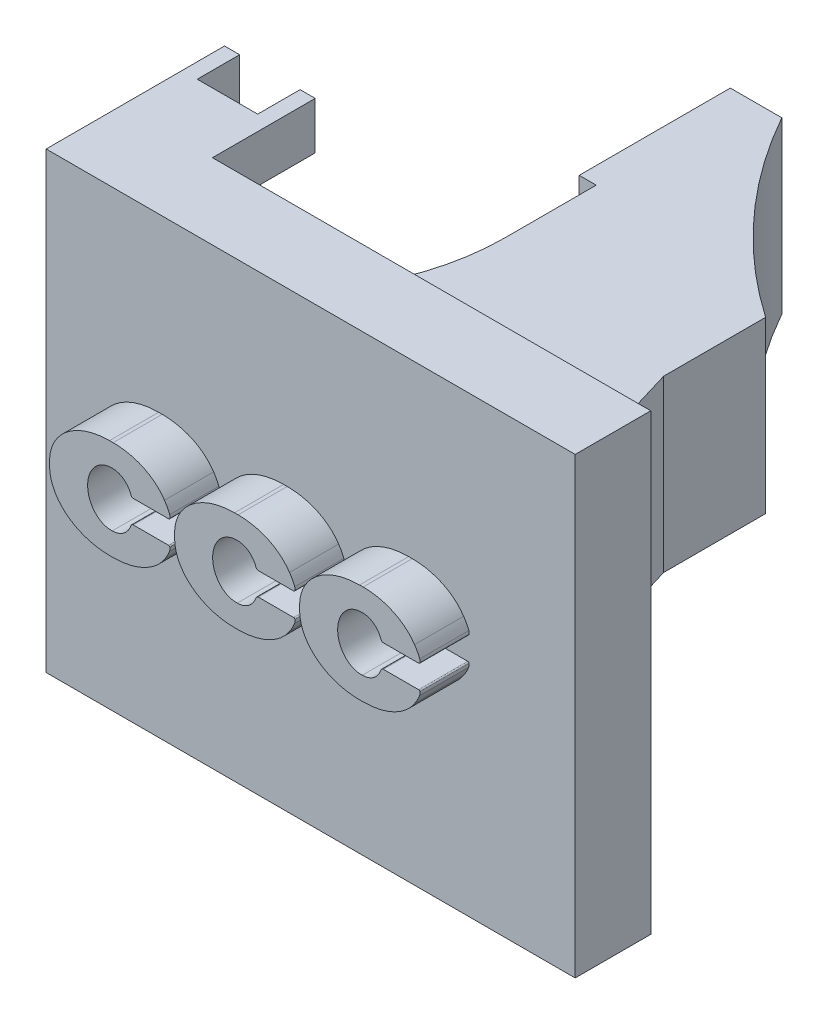
from build123d import *

# Parameters (mm, degrees)
SKETCH1_W            = 15
SKETCH1_H            = 12
BOSS_EXTRUDE1_DEPTH  = 2
BOSS_EXTRUDE2_DEPTH  = 2
BOSS_EXTRUDE3_DEPTH  = 2.25
SKETCH4_W            = 2
SKETCH4_H            = 12
CUT_EXTRUDE1_DEPTH   = 1
CUT_EXTRUDE3_START   = -0.7
CUT_EXTRUDE3_DEPTH   = 0.7
SKETCH7_W            = 4
SKETCH7_H            = 4.5
BOSS_EXTRUDE4_DEPTH  = 0.45
SKETCH8_W            = 0.4
SKETCH8_H            = 2.72025151
BOSS_EXTRUDE5_DEPTH  = 1.25
LPATTERN1_COUNT      = 2
LPATTERN1_PITCH      = 10.75
CUT_EXTRUDE4_DEPTH   = 4.5
BOSS_EXTRUDE10_START = -1.25
SKETCH12_W           = 1.6
SKETCH12_H           = 1.598002806
BOSS_EXTRUDE10_DEPTH = 1.25
SKETCH13_W           = 1.6
SKETCH13_H           = 1.598002806
BOSS_EXTRUDE11_DEPTH = 1.25


with BuildPart() as part:
    # Sketch1 → Boss-Extrude1 (new body)
    with BuildSketch(Plane.XY):
        Rectangle(SKETCH1_W, SKETCH1_H)
    extrude(amount=BOSS_EXTRUDE1_DEPTH)

    # Sketch2 → Boss-Extrude2 (add)
    with BuildSketch(Plane.XY.offset(2)):
        with BuildLine():
            Line((-0.583484164, 0.443787032), (0.352350759, 0.443787032))
            ThreePointArc((0.352350759, 0.443787032), (0.370660979, 0.451874829), (0.381594807, 0.468641703))
            ThreePointArc((0.381594807, 0.468641703), (0.38478126, 0.512633483), (0.377406248, 0.556119567))
            ThreePointArc((0.377406248, 0.556119567), (0.316958398, 0.689104808), (0.240244136, 0.81341868))
            add(Edge.make_bspline(
                [(0.240244136, 0.81341868), (-0.178053426, 1.454553053), (-1.120854898, 1.454553053)],
                knots=[3.484341046, 3.484341046, 3.484341046, 4.522924348, 4.522924348, 4.522924348], degree=2, weights=[1, 0.868170926, 1]))
            Line((-1.120854898, 1.454553053), (-1.214475951, 1.454553068))
            add(Edge.make_bspline(
                [(-1.214475951, 1.454553068), (-2.800132813, 1.454553068), (-2.800132813, 0.203397992)],
                knots=[1.670440536, 1.670440536, 1.670440536, 3.203377674, 3.203377674, 3.203377674], degree=2, weights=[1, 0.720364542, 1]))
            Line((-2.800132813, 0.203397992), (-2.800132806, 0.073267738))
            add(Edge.make_bspline(
                [(-2.800132806, 0.073267738), (-2.800132806, -1.177887338), (-1.214475944, -1.177887338)],
                knots=[3.079807634, 3.079807634, 3.079807634, 4.612744771, 4.612744771, 4.612744771], degree=2, weights=[1, 0.720364542, 1]))
            Line((-1.214475944, -1.177887338), (-1.120854891, -1.177887375))
            add(Edge.make_bspline(
                [(-1.120854891, -1.177887375), (-0.178053419, -1.177887375), (0.240244143, -0.536753002)],
                knots=[1.760260959, 1.760260959, 1.760260959, 2.798844261, 2.798844261, 2.798844261], degree=2, weights=[1, 0.868170926, 1]))
            ThreePointArc((0.240244143, -0.536753002), (0.313994237, -0.417650167), (0.372658208, -0.290437354))
            ThreePointArc((0.372658208, -0.290437354), (0.384251196, -0.24211404), (0.382489087, -0.192450825))
            ThreePointArc((0.382489087, -0.192450825), (0.370484527, -0.171527836), (0.347824512, -0.163257123))
            Line((0.347824512, -0.163257123), (-0.58348421, -0.163257123))
            ThreePointArc((-0.58348421, -0.163257123), (-0.62125204, -0.175257922), (-0.645165579, -0.206858093))
            add(Edge.make_bspline(
                [(-1.141657158, -0.577741646), (-0.776549247, -0.578100851), (-0.645165579, -0.206858093)],
                knots=[5.955155363, 5.955155363, 5.955155363, 7.020735545, 7.020735545, 7.020735545], degree=2, weights=[1, 0.86139323, 1]))
            add(Edge.make_bspline(
                [(-1.201450314, 0.854894524), (-1.823540048, 0.823436889), (-1.793554178, 0.104979402), (-1.763568309, -0.613478086), (-1.141657158, -0.577741646)],
                knots=[0.039432941, 0.039432941, 0.039432941, 1.613207044, 1.613207044, 3.186981147, 3.186981147, 3.186981147], degree=2, weights=[1, 0.706053195, 1, 0.706053195, 1]))
            add(Edge.make_bspline(
                [(-0.645165584, 0.487388037), (-0.79140441, 0.900606071), (-1.201450314, 0.854894524)],
                knots=[2.404042441, 2.404042441, 2.404042441, 3.565685694, 3.565685694, 3.565685694], degree=2, weights=[1, 0.836012096, 1]))
            ThreePointArc((-0.645165584, 0.487388037), (-0.621252025, 0.455787841), (-0.583484164, 0.443787032))
        make_face()
        with BuildLine():
            Line((-3.89178871, 0.443787032), (-2.955953786, 0.443787032))
            ThreePointArc((-2.955953786, 0.443787032), (-2.937643536, 0.451874816), (-2.926709688, 0.468641703))
            ThreePointArc((-2.926709688, 0.468641703), (-2.923523234, 0.512633483), (-2.930898247, 0.556119567))
            ThreePointArc((-2.930898247, 0.556119567), (-2.991346096, 0.689104808), (-3.068060358, 0.81341868))
            add(Edge.make_bspline(
                [(-3.068060358, 0.81341868), (-3.48635792, 1.454553053), (-4.429159392, 1.454553053)],
                knots=[3.484341046, 3.484341046, 3.484341046, 4.522924348, 4.522924348, 4.522924348], degree=2, weights=[1, 0.868170926, 1]))
            Line((-4.429159392, 1.454553053), (-4.522780446, 1.454553068))
            add(Edge.make_bspline(
                [(-4.522780446, 1.454553068), (-6.108437307, 1.454553068), (-6.108437307, 0.203397992)],
                knots=[4.81203319, 4.81203319, 4.81203319, 6.344970327, 6.344970327, 6.344970327], degree=2, weights=[1, 0.720364542, 1]))
            Line((-6.108437307, 0.203397992), (-6.108437352, 0.073267738))
            add(Edge.make_bspline(
                [(-6.108437352, 0.073267738), (-6.108437352, -1.177887338), (-4.52278049, -1.177887338)],
                knots=[6.221400287, 6.221400287, 6.221400287, 7.754337425, 7.754337425, 7.754337425], degree=2, weights=[1, 0.720364542, 1]))
            Line((-4.52278049, -1.177887338), (-4.429159437, -1.177887375))
            add(Edge.make_bspline(
                [(-4.429159437, -1.177887375), (-3.486357965, -1.177887375), (-3.068060402, -0.536753002)],
                knots=[1.760260959, 1.760260959, 1.760260959, 2.798844261, 2.798844261, 2.798844261], degree=2, weights=[1, 0.868170926, 1]))
            ThreePointArc((-3.068060402, -0.536753002), (-2.994310308, -0.417650167), (-2.935646337, -0.290437354))
            ThreePointArc((-2.935646337, -0.290437354), (-2.92405335, -0.24211404), (-2.925815458, -0.192450825))
            ThreePointArc((-2.925815458, -0.192450825), (-2.937820019, -0.171527836), (-2.960480033, -0.163257123))
            Line((-2.960480033, -0.163257123), (-3.891788755, -0.163257123))
            ThreePointArc((-3.891788755, -0.163257123), (-3.929556585, -0.175257922), (-3.953470124, -0.206858093))
            add(Edge.make_bspline(
                [(-4.449961703, -0.577741646), (-4.084853792, -0.578100851), (-3.953470124, -0.206858093)],
                knots=[5.955155363, 5.955155363, 5.955155363, 7.020735545, 7.020735545, 7.020735545], degree=2, weights=[1, 0.86139323, 1]))
            add(Edge.make_bspline(
                [(-4.509754859, 0.854894524), (-5.131844593, 0.82343689), (-5.101858724, 0.104979402), (-5.071872854, -0.613478086), (-4.449961703, -0.577741646)],
                knots=[0.039432941, 0.039432941, 0.039432941, 1.613207044, 1.613207044, 3.186981147, 3.186981147, 3.186981147], degree=2, weights=[1, 0.706053195, 1, 0.706053195, 1]))
            add(Edge.make_bspline(
                [(-3.95347013, 0.487388037), (-4.099708956, 0.900606071), (-4.509754859, 0.854894524)],
                knots=[2.40404244, 2.40404244, 2.40404244, 3.565685694, 3.565685694, 3.565685694], degree=2, weights=[1, 0.836012096, 1]))
            ThreePointArc((-3.95347013, 0.487388037), (-3.92955657, 0.455787841), (-3.89178871, 0.443787032))
        make_face()
        with BuildLine():
            Line((2.724820382, 0.443787032), (3.660655305, 0.443787032))
            ThreePointArc((3.660655305, 0.443787032), (3.678965525, 0.451874829), (3.689899353, 0.468641703))
            ThreePointArc((3.689899353, 0.468641703), (3.693085806, 0.512633483), (3.685710794, 0.556119567))
            ThreePointArc((3.685710794, 0.556119567), (3.625262944, 0.689104808), (3.548548682, 0.81341868))
            add(Edge.make_bspline(
                [(3.548548682, 0.81341868), (3.13025112, 1.454553053), (2.187449648, 1.454553053)],
                knots=[0.342748392, 0.342748392, 0.342748392, 1.381331695, 1.381331695, 1.381331695], degree=2, weights=[1, 0.868170926, 1]))
            Line((2.187449648, 1.454553053), (2.093828595, 1.454553068))
            add(Edge.make_bspline(
                [(2.093828595, 1.454553068), (0.508171733, 1.454553068), (0.508171733, 0.203397992)],
                knots=[4.81203319, 4.81203319, 4.81203319, 6.344970327, 6.344970327, 6.344970327], degree=2, weights=[1, 0.720364542, 1]))
            Line((0.508171733, 0.203397992), (0.50817174, 0.073267738))
            add(Edge.make_bspline(
                [(0.50817174, 0.073267738), (0.50817174, -1.177887338), (2.093828602, -1.177887338)],
                knots=[3.079807634, 3.079807634, 3.079807634, 4.612744771, 4.612744771, 4.612744771], degree=2, weights=[1, 0.720364542, 1]))
            Line((2.093828602, -1.177887338), (2.187449655, -1.177887375))
            add(Edge.make_bspline(
                [(2.187449655, -1.177887375), (3.130251127, -1.177887375), (3.548548689, -0.536753002)],
                knots=[1.760260959, 1.760260959, 1.760260959, 2.798844261, 2.798844261, 2.798844261], degree=2, weights=[1, 0.868170926, 1]))
            ThreePointArc((3.548548689, -0.536753002), (3.622298783, -0.417650167), (3.680962754, -0.290437354))
            ThreePointArc((3.680962754, -0.290437354), (3.692555742, -0.24211404), (3.690793633, -0.192450825))
            ThreePointArc((3.690793633, -0.192450825), (3.678789073, -0.171527836), (3.656129058, -0.163257123))
            Line((3.656129058, -0.163257123), (2.724820336, -0.163257123))
            ThreePointArc((2.724820336, -0.163257123), (2.687052506, -0.175257922), (2.663138967, -0.206858093))
            add(Edge.make_bspline(
                [(2.166647388, -0.577741646), (2.531755299, -0.578100851), (2.663138967, -0.206858093)],
                knots=[5.955155363, 5.955155363, 5.955155363, 7.020735545, 7.020735545, 7.020735545], degree=2, weights=[1, 0.86139323, 1]))
            add(Edge.make_bspline(
                [(2.106854232, 0.854894524), (1.484764498, 0.823436889), (1.514750368, 0.104979402), (1.544736237, -0.613478086), (2.166647388, -0.577741646)],
                knots=[3.181025595, 3.181025595, 3.181025595, 4.754799698, 4.754799698, 6.328573801, 6.328573801, 6.328573801], degree=2, weights=[1, 0.706053195, 1, 0.706053195, 1]))
            add(Edge.make_bspline(
                [(2.663138962, 0.487388037), (2.516900136, 0.900606071), (2.106854232, 0.854894524)],
                knots=[5.545635094, 5.545635094, 5.545635094, 6.707278348, 6.707278348, 6.707278348], degree=2, weights=[1, 0.836012096, 1]))
            ThreePointArc((2.663138962, 0.487388037), (2.687052521, 0.455787841), (2.724820382, 0.443787032))
        make_face()
    extrude(amount=BOSS_EXTRUDE2_DEPTH)

    # Sketch3 → Boss-Extrude3 (add, symmetric)
    with BuildSketch(Plane(origin=(0, 0, 0), x_dir=(1, 0, 0), z_dir=(0, 1, 0))):
        with BuildLine():
            Line((-5.267009627, 0.659268098), (-4.040664768, 2.641993005))
            ThreePointArc((-4.040664768, 2.641993005), (-3.372127042, 4.157552016), (-3.143471892, 5.798155145))
            Line((-3.143471892, 5.798155145), (-3.143471892, 7.885245495))
            Line((-3.143471892, 7.885245495), (-3.143471892, 12.19944937))
            Line((-3.143471892, 12.19944937), (2.127297199, 12.19944937))
            Line((2.127297199, 12.19944937), (2.127297199, 7.885245495))
            Line((2.127297199, 7.885245495), (2.127297199, 4.714947067))
            Line((2.127297199, 4.714947067), (3.22873188, 1.042912685))
            Line((3.22873188, 1.042912685), (3.22873188, 0))
            Line((3.22873188, 0), (-5.267009627, 0))
            Line((-5.267009627, 0), (-5.267009627, 0.659268098))
        make_face()
    extrude(amount=BOSS_EXTRUDE3_DEPTH, both=True)

    # Sketch4 → Cut-Extrude1 (cut)
    with BuildSketch(Plane(origin=(7.5, 0, 0), x_dir=(0, 0, -1), z_dir=(1, 0, 0))):
        with Locations((-1, 0)):
            Rectangle(SKETCH4_W, SKETCH4_H)
    extrude(amount=-CUT_EXTRUDE1_DEPTH, mode=Mode.SUBTRACT)

    # Sketch6 → Cut-Extrude3 (cut)
    with BuildSketch(Plane.XY.offset(4).offset(CUT_EXTRUDE3_START)):
        with BuildLine():
            Line((2.724820382, 0.443787032), (3.660655305, 0.443787032))
            ThreePointArc((3.660655305, 0.443787032), (3.678965525, 0.451874829), (3.689899353, 0.468641703))
            ThreePointArc((3.689899353, 0.468641703), (3.693085806, 0.512633483), (3.685710794, 0.556119567))
            ThreePointArc((3.685710794, 0.556119567), (3.625262944, 0.689104808), (3.548548682, 0.81341868))
            add(Edge.make_bspline(
                [(3.548548682, 0.81341868), (3.13025112, 1.454553053), (2.187449648, 1.454553053)],
                knots=[0.342748392, 0.342748392, 0.342748392, 1.381331695, 1.381331695, 1.381331695], degree=2, weights=[1, 0.868170926, 1]))
            Line((2.187449648, 1.454553053), (2.093828595, 1.454553068))
            add(Edge.make_bspline(
                [(2.093828595, 1.454553068), (0.508171733, 1.454553068), (0.508171733, 0.203397992)],
                knots=[4.81203319, 4.81203319, 4.81203319, 6.344970327, 6.344970327, 6.344970327], degree=2, weights=[1, 0.720364542, 1]))
            Line((0.508171733, 0.203397992), (0.50817174, 0.073267738))
            add(Edge.make_bspline(
                [(0.50817174, 0.073267738), (0.50817174, -1.177887338), (2.093828602, -1.177887338)],
                knots=[3.079807634, 3.079807634, 3.079807634, 4.612744771, 4.612744771, 4.612744771], degree=2, weights=[1, 0.720364542, 1]))
            Line((2.093828602, -1.177887338), (2.187449655, -1.177887375))
            add(Edge.make_bspline(
                [(2.187449655, -1.177887375), (3.130251127, -1.177887375), (3.548548689, -0.536753002)],
                knots=[1.760260959, 1.760260959, 1.760260959, 2.798844261, 2.798844261, 2.798844261], degree=2, weights=[1, 0.868170926, 1]))
            ThreePointArc((3.548548689, -0.536753002), (3.622298783, -0.417650167), (3.680962754, -0.290437354))
            ThreePointArc((3.680962754, -0.290437354), (3.692555742, -0.24211404), (3.690793633, -0.192450825))
            ThreePointArc((3.690793633, -0.192450825), (3.678789073, -0.171527836), (3.656129058, -0.163257123))
            Line((3.656129058, -0.163257123), (2.724820336, -0.163257123))
            ThreePointArc((2.724820336, -0.163257123), (2.687052506, -0.175257922), (2.663138967, -0.206858093))
            add(Edge.make_bspline(
                [(2.166647388, -0.577741646), (2.531755299, -0.578100851), (2.663138967, -0.206858093)],
                knots=[5.955155363, 5.955155363, 5.955155363, 7.020735545, 7.020735545, 7.020735545], degree=2, weights=[1, 0.86139323, 1]))
            add(Edge.make_bspline(
                [(2.106854232, 0.854894524), (1.484764498, 0.823436889), (1.514750368, 0.104979402), (1.544736237, -0.613478086), (2.166647388, -0.577741646)],
                knots=[3.181025595, 3.181025595, 3.181025595, 4.754799698, 4.754799698, 6.328573801, 6.328573801, 6.328573801], degree=2, weights=[1, 0.706053195, 1, 0.706053195, 1]))
            add(Edge.make_bspline(
                [(2.663138962, 0.487388037), (2.516900136, 0.900606071), (2.106854232, 0.854894524)],
                knots=[2.404042441, 2.404042441, 2.404042441, 3.565685694, 3.565685694, 3.565685694], degree=2, weights=[1, 0.836012096, 1]))
            ThreePointArc((2.663138962, 0.487388037), (2.687052521, 0.455787841), (2.724820382, 0.443787032))
        make_face()
        with BuildLine():
            Line((-0.583484164, 0.443787032), (0.352350759, 0.443787032))
            ThreePointArc((0.352350759, 0.443787032), (0.370660979, 0.451874829), (0.381594807, 0.468641703))
            ThreePointArc((0.381594807, 0.468641703), (0.38478126, 0.512633483), (0.377406248, 0.556119567))
            ThreePointArc((0.377406248, 0.556119567), (0.316958398, 0.689104808), (0.240244136, 0.81341868))
            add(Edge.make_bspline(
                [(0.240244136, 0.81341868), (-0.178053426, 1.454553053), (-1.120854898, 1.454553053)],
                knots=[0.342748392, 0.342748392, 0.342748392, 1.381331695, 1.381331695, 1.381331695], degree=2, weights=[1, 0.868170926, 1]))
            Line((-1.120854898, 1.454553053), (-1.214475951, 1.454553068))
            add(Edge.make_bspline(
                [(-1.214475951, 1.454553068), (-2.800132813, 1.454553068), (-2.800132813, 0.203397992)],
                knots=[4.81203319, 4.81203319, 4.81203319, 6.344970327, 6.344970327, 6.344970327], degree=2, weights=[1, 0.720364542, 1]))
            Line((-2.800132813, 0.203397992), (-2.800132806, 0.073267738))
            add(Edge.make_bspline(
                [(-2.800132806, 0.073267738), (-2.800132806, -1.177887338), (-1.214475944, -1.177887338)],
                knots=[3.079807634, 3.079807634, 3.079807634, 4.612744771, 4.612744771, 4.612744771], degree=2, weights=[1, 0.720364542, 1]))
            Line((-1.214475944, -1.177887338), (-1.120854891, -1.177887375))
            add(Edge.make_bspline(
                [(-1.120854891, -1.177887375), (-0.178053419, -1.177887375), (0.240244143, -0.536753002)],
                knots=[1.760260959, 1.760260959, 1.760260959, 2.798844261, 2.798844261, 2.798844261], degree=2, weights=[1, 0.868170926, 1]))
            ThreePointArc((0.240244143, -0.536753002), (0.313994237, -0.417650167), (0.372658208, -0.290437354))
            ThreePointArc((0.372658208, -0.290437354), (0.384251196, -0.24211404), (0.382489087, -0.192450825))
            ThreePointArc((0.382489087, -0.192450825), (0.370484527, -0.171527836), (0.347824512, -0.163257123))
            Line((0.347824512, -0.163257123), (-0.58348421, -0.163257123))
            ThreePointArc((-0.58348421, -0.163257123), (-0.62125204, -0.175257922), (-0.645165579, -0.206858093))
            add(Edge.make_bspline(
                [(-1.141657158, -0.577741646), (-0.776549247, -0.578100851), (-0.645165579, -0.206858093)],
                knots=[5.955155363, 5.955155363, 5.955155363, 7.020735545, 7.020735545, 7.020735545], degree=2, weights=[1, 0.86139323, 1]))
            add(Edge.make_bspline(
                [(-1.201450314, 0.854894524), (-1.823540048, 0.823436889), (-1.793554178, 0.104979402), (-1.763568309, -0.613478086), (-1.141657158, -0.577741646)],
                knots=[3.181025595, 3.181025595, 3.181025595, 4.754799698, 4.754799698, 6.328573801, 6.328573801, 6.328573801], degree=2, weights=[1, 0.706053195, 1, 0.706053195, 1]))
            add(Edge.make_bspline(
                [(-0.645165584, 0.487388037), (-0.79140441, 0.900606071), (-1.201450314, 0.854894524)],
                knots=[2.404042441, 2.404042441, 2.404042441, 3.565685694, 3.565685694, 3.565685694], degree=2, weights=[1, 0.836012096, 1]))
            ThreePointArc((-0.645165584, 0.487388037), (-0.621252025, 0.455787841), (-0.583484164, 0.443787032))
        make_face()
        with BuildLine():
            Line((-3.89178871, 0.443787032), (-2.955953786, 0.443787032))
            ThreePointArc((-2.955953786, 0.443787032), (-2.937643536, 0.451874816), (-2.926709688, 0.468641703))
            ThreePointArc((-2.926709688, 0.468641703), (-2.923523234, 0.512633483), (-2.930898247, 0.556119567))
            ThreePointArc((-2.930898247, 0.556119567), (-2.991346096, 0.689104808), (-3.068060358, 0.81341868))
            add(Edge.make_bspline(
                [(-3.068060358, 0.81341868), (-3.48635792, 1.454553053), (-4.429159392, 1.454553053)],
                knots=[0.342748392, 0.342748392, 0.342748392, 1.381331695, 1.381331695, 1.381331695], degree=2, weights=[1, 0.868170926, 1]))
            Line((-4.429159392, 1.454553053), (-4.522780446, 1.454553068))
            add(Edge.make_bspline(
                [(-4.522780446, 1.454553068), (-6.108437307, 1.454553068), (-6.108437307, 0.203397992)],
                knots=[4.81203319, 4.81203319, 4.81203319, 6.344970327, 6.344970327, 6.344970327], degree=2, weights=[1, 0.720364542, 1]))
            Line((-6.108437307, 0.203397992), (-6.108437352, 0.073267738))
            add(Edge.make_bspline(
                [(-6.108437352, 0.073267738), (-6.108437352, -1.177887338), (-4.52278049, -1.177887338)],
                knots=[3.079807634, 3.079807634, 3.079807634, 4.612744771, 4.612744771, 4.612744771], degree=2, weights=[1, 0.720364542, 1]))
            Line((-4.52278049, -1.177887338), (-4.429159437, -1.177887375))
            add(Edge.make_bspline(
                [(-4.429159437, -1.177887375), (-3.486357965, -1.177887375), (-3.068060402, -0.536753002)],
                knots=[1.760260959, 1.760260959, 1.760260959, 2.798844261, 2.798844261, 2.798844261], degree=2, weights=[1, 0.868170926, 1]))
            ThreePointArc((-3.068060402, -0.536753002), (-2.994310308, -0.417650167), (-2.935646337, -0.290437354))
            ThreePointArc((-2.935646337, -0.290437354), (-2.92405335, -0.24211404), (-2.925815458, -0.192450825))
            ThreePointArc((-2.925815458, -0.192450825), (-2.937820019, -0.171527836), (-2.960480033, -0.163257123))
            Line((-2.960480033, -0.163257123), (-3.891788755, -0.163257123))
            ThreePointArc((-3.891788755, -0.163257123), (-3.929556585, -0.175257922), (-3.953470124, -0.206858093))
            add(Edge.make_bspline(
                [(-4.449961703, -0.577741646), (-4.084853792, -0.578100851), (-3.953470124, -0.206858093)],
                knots=[5.955155363, 5.955155363, 5.955155363, 7.020735545, 7.020735545, 7.020735545], degree=2, weights=[1, 0.86139323, 1]))
            add(Edge.make_bspline(
                [(-4.509754859, 0.854894524), (-5.131844593, 0.82343689), (-5.101858724, 0.104979402), (-5.071872854, -0.613478086), (-4.449961703, -0.577741646)],
                knots=[3.181025595, 3.181025595, 3.181025595, 4.754799698, 4.754799698, 6.328573801, 6.328573801, 6.328573801], degree=2, weights=[1, 0.706053195, 1, 0.706053195, 1]))
            add(Edge.make_bspline(
                [(-3.95347013, 0.487388037), (-4.099708956, 0.900606071), (-4.509754859, 0.854894524)],
                knots=[2.40404244, 2.40404244, 2.40404244, 3.565685694, 3.565685694, 3.565685694], degree=2, weights=[1, 0.836012096, 1]))
            ThreePointArc((-3.95347013, 0.487388037), (-3.92955657, 0.455787841), (-3.89178871, 0.443787032))
        make_face()
    extrude(amount=CUT_EXTRUDE3_DEPTH, mode=Mode.SUBTRACT)

    # Sketch7 → Boss-Extrude4 (add)
    with BuildSketch(Plane.ZY.offset(3.143471892)):
        with Locations((-10.19944937, 0)):
            Rectangle(SKETCH7_W, SKETCH7_H)
    extrude(amount=BOSS_EXTRUDE4_DEPTH)

    # Sketch8 → Boss-Extrude5 (add)
    with BuildSketch(Plane(origin=(0, 6, 0), x_dir=(1, 0, 0), z_dir=(0, 1, 0))):
        with Locations((-7.3, 1.360125755)):
            Rectangle(SKETCH8_W, SKETCH8_H)
        with Locations((-5.3, 1.360125755)):
            Rectangle(SKETCH8_W, SKETCH8_H)
    boss_extrude5 = extrude(amount=-BOSS_EXTRUDE5_DEPTH)

    # LPattern1: Boss-Extrude5 ×2
    with Locations(*[(0, -i * LPATTERN1_PITCH, 0) for i in range(1, LPATTERN1_COUNT)]):
        add(boss_extrude5)

    # Sketch11 → Cut-Extrude4 (cut)
    with BuildSketch(Plane(origin=(0, 2.25, 0), x_dir=(1, 0, 0), z_dir=(0, 1, 0))):
        with BuildLine():
            Line((-2.230616354, 12.19944937), (2.127297199, 12.19944937))
            Line((2.127297199, 12.19944937), (2.127297199, 7.412882239))
            ThreePointArc((2.127297199, 7.412882239), (-0.326306783, 9.556114202), (-2.230616354, 12.19944937))
        make_face()
    extrude(amount=-CUT_EXTRUDE4_DEPTH, mode=Mode.SUBTRACT)

    # Sketch12 → Boss-Extrude10 (add)
    with BuildSketch(Plane(origin=(0, 6, 0), x_dir=(1, 0, 0), z_dir=(0, 1, 0)).offset(BOSS_EXTRUDE10_START)):
        with Locations((-6.3, 0.799001403)):
            Rectangle(SKETCH12_W, SKETCH12_H)
    extrude(amount=BOSS_EXTRUDE10_DEPTH)

    # Sketch13 → Boss-Extrude11 (add)
    with BuildSketch(Plane.XZ.offset(6)):
        with Locations((-6.3, -0.799001403)):
            Rectangle(SKETCH13_W, SKETCH13_H)
    extrude(amount=-BOSS_EXTRUDE11_DEPTH)


solid = part.part
